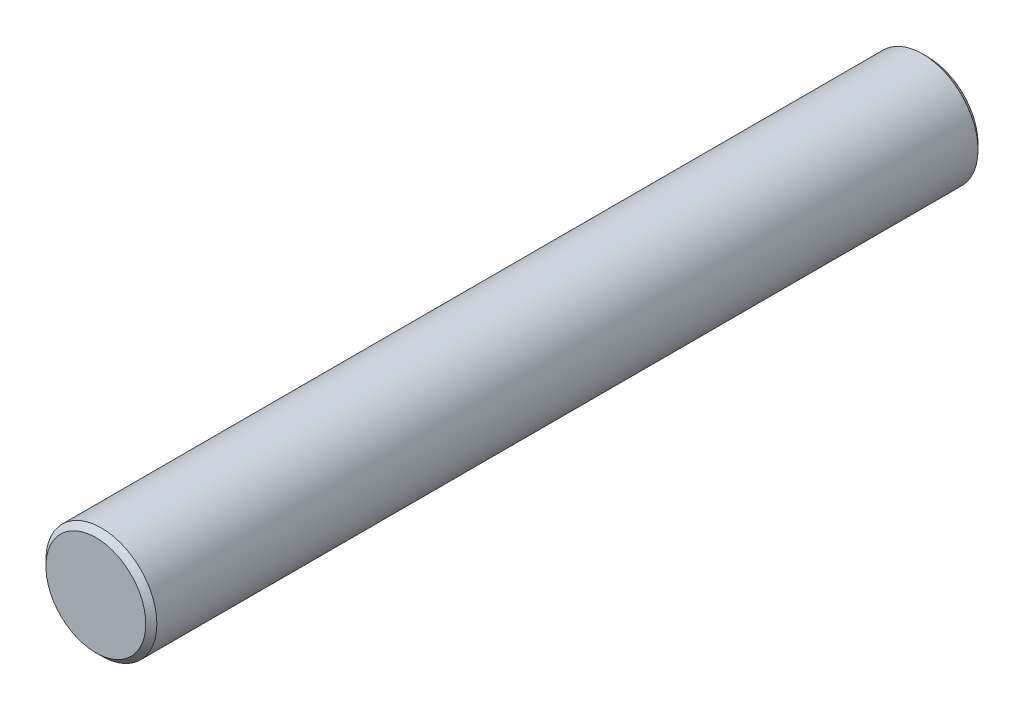
from build123d import *

# Parameters (mm, degrees)
SKETCH_1_R      = 2
EXTRUDE_1_DEPTH = 30
CHAMFER_1_SIZE  = 0.2


with BuildPart() as part:
    # 草图1 → 凸台-拉伸1 (new body)
    with BuildSketch(Plane.XY):
        Circle(SKETCH_1_R)
    extrude(amount=EXTRUDE_1_DEPTH)

    # 倒角1
    chamfer_1_edges = [part.edges().sort_by_distance(p)[0] for p in [
        (-2, 0, 0),
        (-2, 0, 30),
    ]]
    chamfer(chamfer_1_edges, length=CHAMFER_1_SIZE)


solid = part.part
